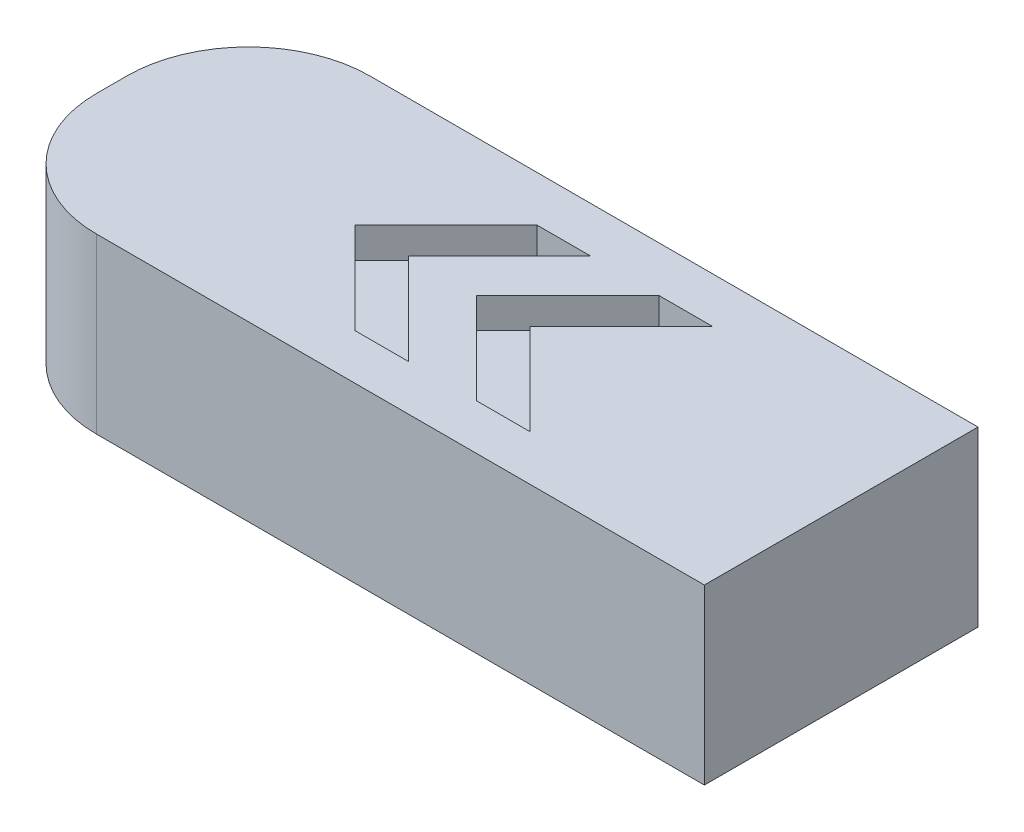
from build123d import *

# Parameters (mm, degrees)
SKETCH1_W           = 24
SKETCH1_H           = 9
BOSS_EXTRUDE1_DEPTH = 5.7
FILLET1_R           = 4
FILLET2_R           = 4
CUT_EXTRUDE2_DEPTH  = 1
LPATTERN1_COUNT     = 2
LPATTERN1_PITCH     = 4


with BuildPart() as part:
    # Sketch1 → Boss-Extrude1 (new body)
    with BuildSketch(Plane(origin=(0, 0, 0), x_dir=(1, 0, 0), z_dir=(0, 1, 0))):
        with Locations((12, 4.5)):
            Rectangle(SKETCH1_W, SKETCH1_H)
    extrude(amount=BOSS_EXTRUDE1_DEPTH)

    # Fillet1
    fillet1_edges = [part.edges().sort_by_distance(p)[0] for p in [
        (0, 2.85, 0),
    ]]
    fillet(fillet1_edges, radius=FILLET1_R)

    # Fillet2
    fillet2_edges = [part.edges().sort_by_distance(p)[0] for p in [
        (0, 2.85, -9),
    ]]
    fillet(fillet2_edges, radius=FILLET2_R)

    # Sketch2 → Cut-Extrude2 (cut)
    with BuildSketch(Plane(origin=(0, 5.7, 0), x_dir=(1, 0, 0), z_dir=(0, 1, 0))):
        Polygon((12.767766953, 1.5), (11, 1.5), (8, 4.5), (11, 7.5), (12.767766953, 7.5), (9.767766953, 4.5), align=None)
    cut_extrude2 = extrude(amount=-CUT_EXTRUDE2_DEPTH, mode=Mode.SUBTRACT)

    # LPattern1: Cut-Extrude2 ×2
    with Locations(*[(i * LPATTERN1_PITCH, 0, 0) for i in range(1, LPATTERN1_COUNT)]):
        add(cut_extrude2, mode=Mode.SUBTRACT)


solid = part.part
